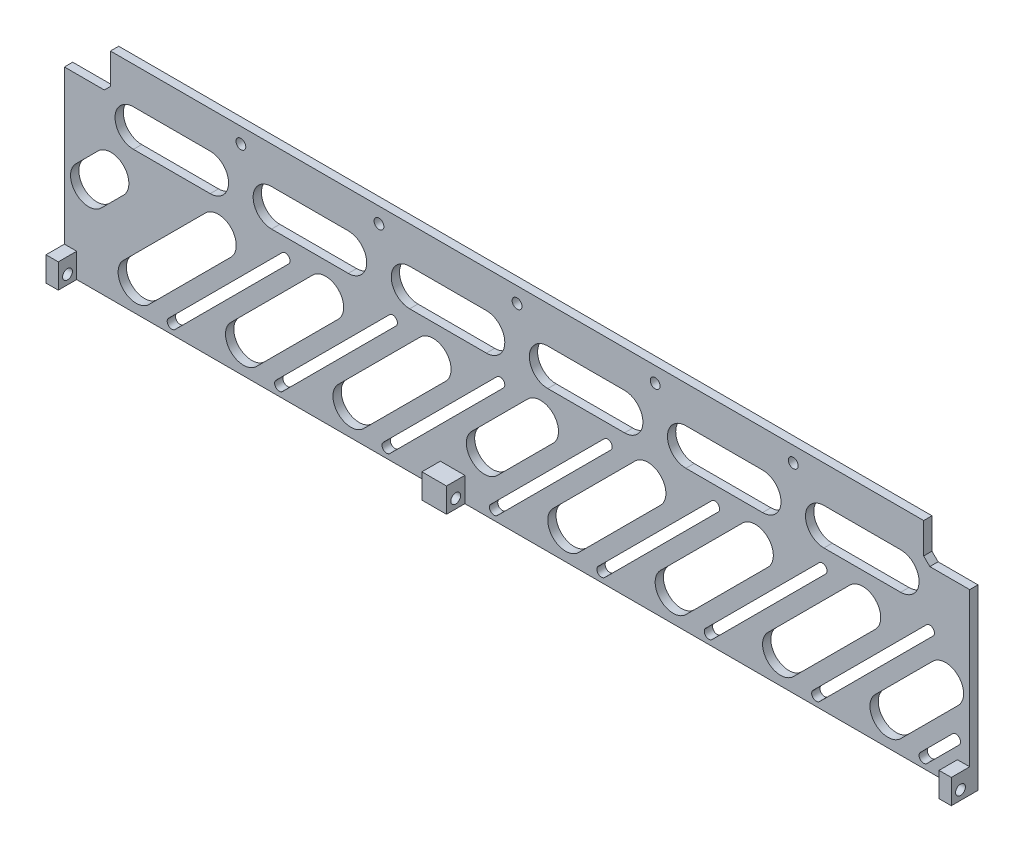
from build123d import *

# Parameters (mm, degrees)
SKETCH_1_W               = 295
SKETCH_1_H               = 70
EXTRUDE_1_DEPTH          = 2.7
CUT_EXTRUDE_5_DEPTH      = 10
CUT_EXTRUDE_1_DEPTH      = 152.619721672
PATTERN_LINEAR_1_COUNT   = 7
PATTERN_LINEAR_1_PITCH   = 35
CUT_EXTRUDE_4_DEPTH      = 152.619721672
SKETCH_5_W               = 4
SKETCH_5_H               = 8
SKETCH_5_W_2             = 8
EXTRUDE_3_DEPTH          = 6
CUT_EXTRUDE_3_DEPTH      = 294.22634602
CUT_EXTRUDE_3_DEPTH_BACK = 294.22634602
SKETCH_7_R               = 1.6
CUT_EXTRUDE_6_DEPTH      = 152.714369787
PATTERN_LINEAR_2_COUNT   = 7
PATTERN_LINEAR_2_PITCH   = 35
PATTERN_LINEAR_3_COUNT   = 3
PATTERN_LINEAR_3_PITCH   = 35
CUT_EXTRUDE_7_DEPTH      = 152.714369787
PATTERN_LINEAR_4_COUNT   = 4
PATTERN_LINEAR_4_PITCH   = 45
PATTERN_LINEAR_5_COUNT   = 3
PATTERN_LINEAR_5_PITCH   = 45
EXTRUDE_4_DEPTH          = 2.7
SKETCH_15_R              = 1.6
CUT_EXTRUDE_8_DEPTH      = 10


with BuildPart() as part:
    # 草图1 → 凸台-拉伸1 (new body)
    with BuildSketch(Plane.XY):
        Rectangle(SKETCH_1_W, SKETCH_1_H)
    extrude(amount=EXTRUDE_1_DEPTH)

    # 草图11 → 切除-拉伸5 (cut)
    with BuildSketch(Plane.XY.offset(2.7)):
        Polygon((-147.5, 35), (-147.5, 23), (-134.5, 23), (-132.5, 25), (-132.5, 35), align=None)
        Polygon((132.5, 35), (147.5, 35), (147.5, 23), (134.5, 23), (132.5, 25), align=None)
    extrude(amount=-CUT_EXTRUDE_5_DEPTH, mode=Mode.SUBTRACT)

    # 草图2 → 切除-拉伸1 (cut, through all)
    with BuildSketch(Plane.XY.offset(2.7)):
        with BuildLine():
            Line((-113.560660172, -30.939339828), (-76.560660172, 6.060660172))
            ThreePointArc((-76.560660172, 6.060660172), (-74.439339828, 6.060660172), (-74.439339828, 3.939339828))
            Line((-74.439339828, 3.939339828), (-111.439339828, -33.060660172))
            ThreePointArc((-111.439339828, -33.060660172), (-113.560660172, -33.060660172), (-113.560660172, -30.939339828))
        make_face()
    cut_extrude_1 = extrude(amount=-CUT_EXTRUDE_1_DEPTH, mode=Mode.SUBTRACT)

    # 阵列(线性)1: 切除-拉伸1 ×7
    with Locations(*[(i * PATTERN_LINEAR_1_PITCH, 0, 0) for i in range(1, PATTERN_LINEAR_1_COUNT)]):
        add(cut_extrude_1, mode=Mode.SUBTRACT)

    # 草图10 → 切除-拉伸4 (cut, through all)
    with BuildSketch(Plane.XY.offset(2.7)):
        with BuildLine():
            Line((131.439339828, -30.939339828), (141.939339828, -20.439339828))
            ThreePointArc((141.939339828, -20.439339828), (144.060660172, -20.439339828), (144.060660172, -22.560660172))
            Line((144.060660172, -22.560660172), (133.560660172, -33.060660172))
            ThreePointArc((133.560660172, -33.060660172), (131.439339828, -33.060660172), (131.439339828, -30.939339828))
        make_face()
    extrude(amount=-CUT_EXTRUDE_4_DEPTH, mode=Mode.SUBTRACT)

    # 草图5 → 凸台-拉伸3 (add)
    with BuildSketch(Plane.XY.offset(2.7)):
        with Locations((-145.5, -31)):
            Rectangle(SKETCH_5_W, SKETCH_5_H)
        with Locations((145.5, -31)):
            Rectangle(SKETCH_5_W, SKETCH_5_H)
        with Locations((-21, -31)):
            Rectangle(SKETCH_5_W_2, SKETCH_5_H)
    extrude(amount=EXTRUDE_3_DEPTH)

    # 草图7 → 切除-拉伸3 (cut, two sides: drawn at the far end of the back side and taken through both)
    with BuildSketch(Plane(origin=(-143.5, 0, 0), x_dir=(0, 0, -1), z_dir=(1, 0, 0)).offset(-CUT_EXTRUDE_3_DEPTH_BACK)):
        with Locations((-5.7, -32)):
            Circle(SKETCH_7_R)
    extrude(amount=CUT_EXTRUDE_3_DEPTH + CUT_EXTRUDE_3_DEPTH_BACK, mode=Mode.SUBTRACT)

    # 草图12 → 切除-拉伸6 (cut, through all)
    with BuildSketch(Plane.XY.offset(2.7)):
        with BuildLine():
            Line((-93.279437252, -21.971825407), (-66.528174593, 4.779437252))
            ThreePointArc((-66.528174593, 4.779437252), (-58.220562748, 4.779437252), (-58.220562748, -3.528174593))
            Line((-58.220562748, -3.528174593), (-84.971825407, -30.279437252))
            ThreePointArc((-84.971825407, -30.279437252), (-93.279437252, -30.279437252), (-93.279437252, -21.971825407))
        make_face()
    cut_extrude_6 = extrude(amount=-CUT_EXTRUDE_6_DEPTH, mode=Mode.SUBTRACT)

    # 阵列(线性)2: 切除-拉伸6 ×7
    with Locations(*[(i * PATTERN_LINEAR_2_PITCH, 0, 0) for i in range(1, PATTERN_LINEAR_2_COUNT)]):
        add(cut_extrude_6, mode=Mode.SUBTRACT)

    # 阵列(线性)3: 切除-拉伸6 ×3
    with Locations(*[(-i * PATTERN_LINEAR_3_PITCH, 0, 0) for i in range(1, PATTERN_LINEAR_3_COUNT)]):
        add(cut_extrude_6, mode=Mode.SUBTRACT)

    # 草图13 → 切除-拉伸7 (cut, through all)
    with BuildSketch(Plane.XY.offset(2.7)):
        with BuildLine():
            Line((-35, 23), (-10, 23))
            ThreePointArc((-10, 23), (-4, 17), (-10, 11))
            Line((-10, 11), (-35, 11))
            ThreePointArc((-35, 11), (-41, 17), (-35, 23))
        make_face()
    cut_extrude_7 = extrude(amount=-CUT_EXTRUDE_7_DEPTH, mode=Mode.SUBTRACT)

    # 阵列(线性)4: 切除-拉伸7 ×4
    with Locations(*[(i * PATTERN_LINEAR_4_PITCH, 0, 0) for i in range(1, PATTERN_LINEAR_4_COUNT)]):
        add(cut_extrude_7, mode=Mode.SUBTRACT)

    # 阵列(线性)5: 切除-拉伸7 ×3
    with Locations(*[(-i * PATTERN_LINEAR_5_PITCH, 0, 0) for i in range(1, PATTERN_LINEAR_5_COUNT)]):
        add(cut_extrude_7, mode=Mode.SUBTRACT)

    # 草图14 → 凸台-拉伸4 (add)
    with BuildSketch(Plane.XY.offset(2.7)):
        with BuildLine():
            Line((-143.779437252, -2.471825407), (-147.5, -6.192388155))
            Line((-147.5, -6.192388155), (-147.5, -22.807611845))
            Line((-147.5, -22.807611845), (-135.471825407, -10.779437252))
            ThreePointArc((-135.471825407, -10.779437252), (-143.779437252, -10.779437252), (-143.779437252, -2.471825407))
        make_face()
        with BuildLine():
            Line((143.471825407, 4.779437252), (135.471825407, -3.220562748))
            ThreePointArc((135.471825407, -3.220562748), (143.779437252, -3.220562748), (143.779437252, -11.528174593))
            Line((143.779437252, -11.528174593), (147.5, -7.807611845))
            Line((147.5, -7.807611845), (147.5, 6.498656448))
            ThreePointArc((147.5, 6.498656448), (145.31969888, 6.028490093), (143.471825407, 4.779437252))
        make_face()
        with BuildLine():
            Line((-14.794155877, -13.486544033), (-23.279437252, -21.971825407))
            ThreePointArc((-23.279437252, -21.971825407), (-23.279437252, -30.279437252), (-14.971825407, -30.279437252))
            Line((-14.971825407, -30.279437252), (-6.486544033, -21.794155877))
            ThreePointArc((-6.486544033, -21.794155877), (-14.794155877, -21.794155877), (-14.794155877, -13.486544033))
        make_face()
    extrude(amount=-EXTRUDE_4_DEPTH)

    # 草图15 → 切除-拉伸8 (cut)
    with BuildSketch(Plane.XY.offset(2.7)):
        with Locations((-90, 30)):
            Circle(SKETCH_15_R)
        with Locations((-45, 30)):
            Circle(SKETCH_15_R)
        with Locations((45, 30)):
            Circle(SKETCH_15_R)
        with Locations((90, 30)):
            Circle(SKETCH_15_R)
        with Locations((0, 30)):
            Circle(SKETCH_15_R)
    extrude(amount=-CUT_EXTRUDE_8_DEPTH, mode=Mode.SUBTRACT)


solid = part.part
